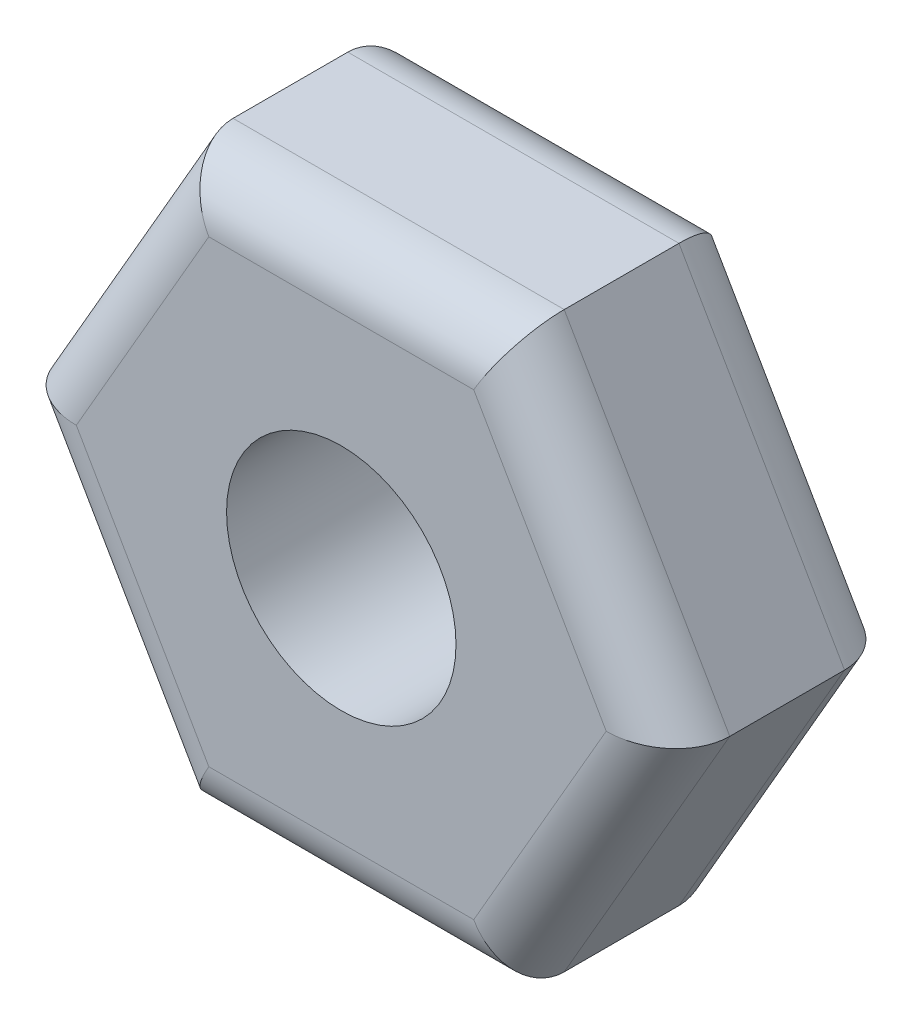
from build123d import *

# Parameters (mm, degrees)
CROQUIS1_R              = 2
SALIENTE_EXTRUIR1_DEPTH = 4
REDONDEO2_R             = 1
REDONDEO3_R             = 1


with BuildPart() as part:
    # Croquis1 → Saliente-Extruir1 (new body)
    with BuildSketch(Plane.XY):
        Polygon((5.773502692, 0), (2.886751346, 5), (-2.886751346, 5), (-5.773502692, 0), (-2.886751346, -5), (2.886751346, -5), align=None)
        Circle(CROQUIS1_R, mode=Mode.SUBTRACT)
    extrude(amount=SALIENTE_EXTRUIR1_DEPTH)

    # Redondeo2
    redondeo2_edges = [part.edges().sort_by_distance(p)[0] for p in [
        (0, 5, 4),
        (-4.330127019, 2.5, 4),
        (-4.330127019, -2.5, 4),
        (0, -5, 4),
        (4.330127019, -2.5, 4),
        (4.330127019, 2.5, 4),
    ]]
    fillet(redondeo2_edges, radius=REDONDEO2_R)

    # Redondeo3
    redondeo3_edges = [part.edges().sort_by_distance(p)[0] for p in [
        (0, -5, 0),
        (-4.330127019, -2.5, 0),
        (-4.330127019, 2.5, 0),
        (0, 5, 0),
        (4.330127019, 2.5, 0),
        (4.330127019, -2.5, 0),
    ]]
    fillet(redondeo3_edges, radius=REDONDEO3_R)


solid = part.part
